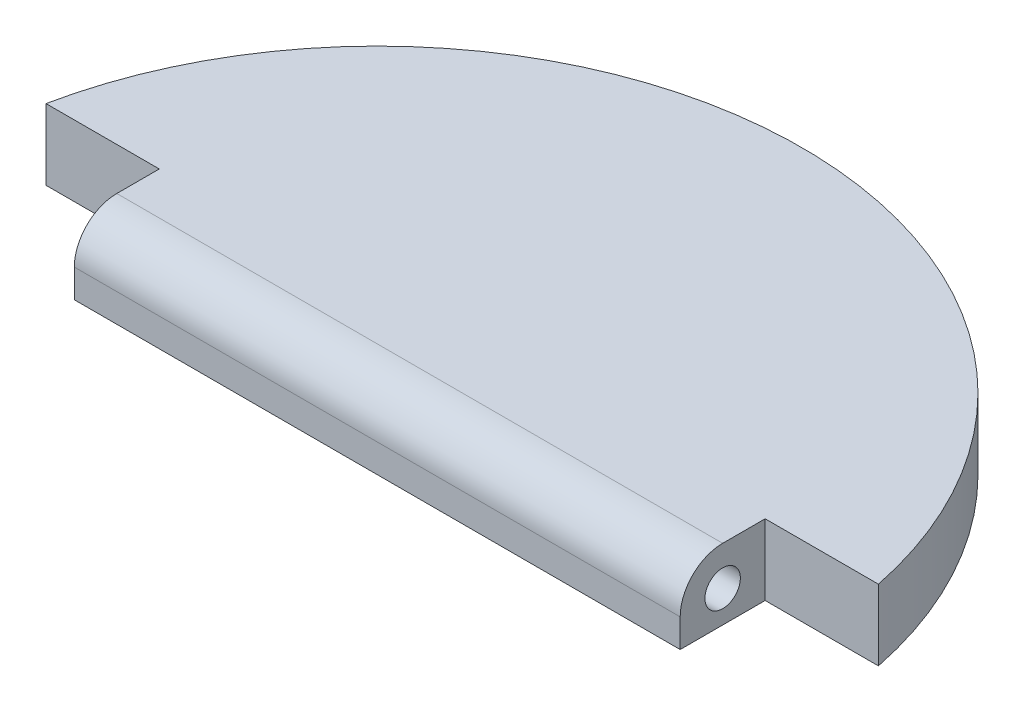
from build123d import *

# Parameters (mm, degrees)
BOSS_EXTRUDE1_DEPTH = 5
CUT_EXTRUDE1_START  = -10
CUT_EXTRUDE1_DEPTH  = 10
FILLET2_R           = 3
SKETCH6_R           = 1.25
CUT_EXTRUDE2_DEPTH  = 3
CUT_EXTRUDE3_START  = -3
SKETCH7_R           = 1.25
CUT_EXTRUDE3_DEPTH  = 3


with BuildPart() as part:
    # Sketch1 → Boss-Extrude1 (new body)
    with BuildSketch(Plane(origin=(0, 0, 0), x_dir=(1, 0, 0), z_dir=(0, 1, 0))):
        with BuildLine():
            Line((-30, 0), (30, 0))
            ThreePointArc((30, 0), (0, 30), (-30, 0))
        make_face()
    extrude(amount=BOSS_EXTRUDE1_DEPTH)

    # Sketch5 → Cut-Extrude1 (cut)
    with BuildSketch(Plane(origin=(0, 5, 0), x_dir=(1, 0, 0), z_dir=(0, 1, 0)).offset(CUT_EXTRUDE1_START)):
        with BuildLine():
            Line((-21.393876913, 0), (-21.393876913, 6))
            Line((-21.393876913, 6), (-29.393876913, 6))
            ThreePointArc((-29.393876913, 6), (-29.84808459, 3.01526886), (-30, 0))
            Line((-30, 0), (-21.393876913, 0))
        make_face()
        with BuildLine():
            Line((21.393876913, 6), (29.393876913, 6))
            ThreePointArc((29.393876913, 6), (29.84808459, 3.01526886), (30, 0))
            Line((30, 0), (21.393876913, 0))
            Line((21.393876913, 0), (21.393876913, 6))
        make_face()
    extrude(amount=CUT_EXTRUDE1_DEPTH, mode=Mode.SUBTRACT)

    # Fillet2
    fillet2_edges = [part.edges().sort_by_distance(p)[0] for p in [
        (0, 5, 0),
    ]]
    fillet(fillet2_edges, radius=FILLET2_R)

    # Sketch6 → Cut-Extrude2 (cut)
    with BuildSketch(Plane(origin=(21.393876913, 0, 0), x_dir=(0, 0, -1), z_dir=(1, 0, 0))):
        with Locations((3, 2.25)):
            Circle(SKETCH6_R)
    extrude(amount=-CUT_EXTRUDE2_DEPTH, mode=Mode.SUBTRACT)

    # Sketch7 → Cut-Extrude3 (cut)
    with BuildSketch(Plane.ZY.offset(21.393876913).offset(CUT_EXTRUDE3_START)):
        with Locations(Location((-3, 2.25, 0), (0, 0, 180))):
            Circle(SKETCH7_R)
    extrude(amount=CUT_EXTRUDE3_DEPTH, mode=Mode.SUBTRACT)


solid = part.part
